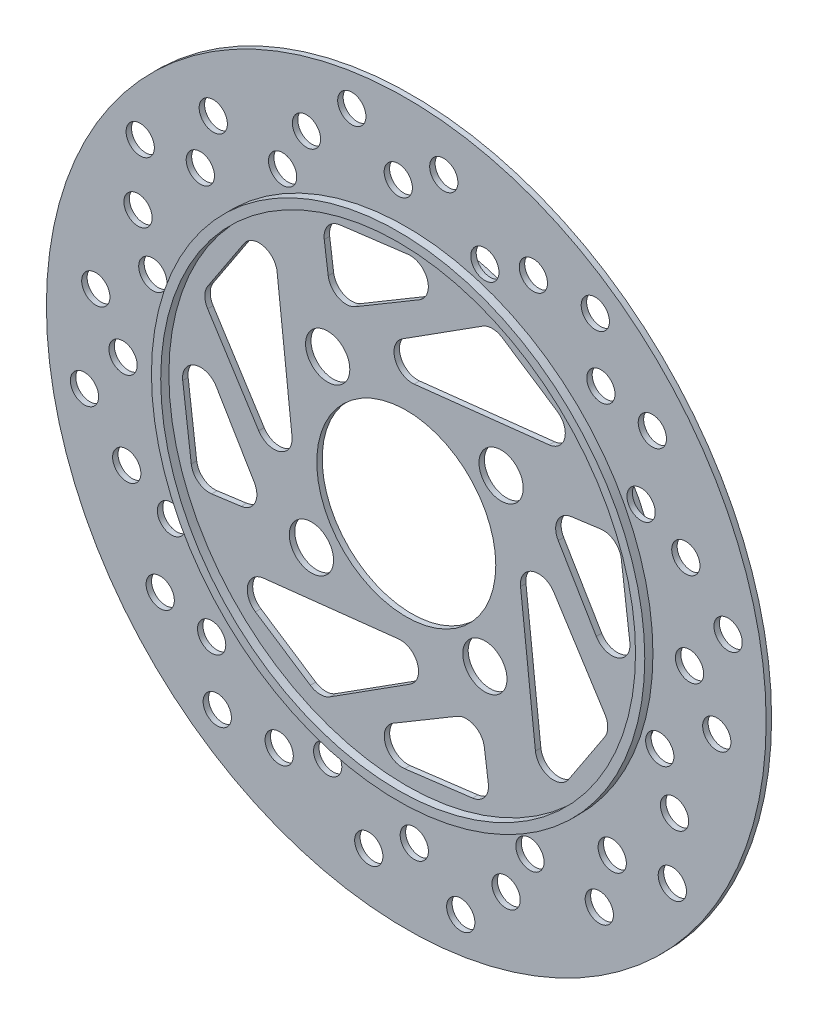
from build123d import *

# Parameters (mm, degrees)
SKETCH2_R             = 198.40424038
SKETCH2_R_2           = 135.985879118
SKETCH2_R_3           = 7.784933854
BOSS_EXTRUDE2_DEPTH   = 1.5
SKETCH2_R_4           = 130.883760353
SKETCH2_R_5           = 49.343667584
SKETCH2_R_6           = 12.196246353
BOSS_EXTRUDE2_2_DEPTH = 1.5
SKETCH3_R             = 135.985879118
SKETCH3_R_2           = 130.883760353
BOSS_EXTRUDE3_DEPTH   = 6
SCALE1_SCALE          = 0.55


with BuildPart() as part:
    # Sketch2 → Boss-Extrude2 (new, symmetric)
    with BuildSketch(Plane.XY):
        with Locations((202.835151523, 204.337269437)):
            Circle(SKETCH2_R)
        with Locations((202.835151523, 205.328991248)):
            Circle(SKETCH2_R_2, mode=Mode.SUBTRACT)
        with Locations((31.671364892, 226.003469352)):
            Circle(SKETCH2_R_3, mode=Mode.SUBTRACT)
        with Locations((46.695167001, 200.915529744)):
            Circle(SKETCH2_R_3, mode=Mode.SUBTRACT)
        with Locations((48.726085629, 150.308347166)):
            Circle(SKETCH2_R_3, mode=Mode.SUBTRACT)
        with Locations((73.387276697, 137.156776347)):
            Circle(SKETCH2_R_3, mode=Mode.SUBTRACT)
        with Locations((25.436259388, 175.296925506)):
            Circle(SKETCH2_R_3, mode=Mode.SUBTRACT)
        with Locations((89.306721095, 312.615844559)):
            Circle(SKETCH2_R_3, mode=Mode.SUBTRACT)
        with Locations((96.423140967, 340.979129133)):
            Circle(SKETCH2_R_3, mode=Mode.SUBTRACT)
        with Locations((56.15931458, 309.533073513)):
            Circle(SKETCH2_R_3, mode=Mode.SUBTRACT)
        with Locations((54.958115451, 275.395086249)):
            Circle(SKETCH2_R_3, mode=Mode.SUBTRACT)
        with Locations((63.096645978, 248.657425903)):
            Circle(SKETCH2_R_3, mode=Mode.SUBTRACT)
        with Locations((198.421690018, 361.46897577)):
            Circle(SKETCH2_R_3, mode=Mode.SUBTRACT)
        with Locations((223.509629626, 376.492777879)):
            Circle(SKETCH2_R_3, mode=Mode.SUBTRACT)
        with Locations((172.803085781, 382.727883384)):
            Circle(SKETCH2_R_3, mode=Mode.SUBTRACT)
        with Locations((147.814507441, 359.438057143)):
            Circle(SKETCH2_R_3, mode=Mode.SUBTRACT)
        with Locations((134.662936621, 334.776866075)):
            Circle(SKETCH2_R_3, mode=Mode.SUBTRACT)
        with Locations((310.122004834, 318.857421676)):
            Circle(SKETCH2_R_3, mode=Mode.SUBTRACT)
        with Locations((338.485289407, 311.741001804)):
            Circle(SKETCH2_R_3, mode=Mode.SUBTRACT)
        with Locations((307.039233787, 352.004828191)):
            Circle(SKETCH2_R_3, mode=Mode.SUBTRACT)
        with Locations((272.901246523, 353.20602732)):
            Circle(SKETCH2_R_3, mode=Mode.SUBTRACT)
        with Locations((246.163586177, 345.067496794)):
            Circle(SKETCH2_R_3, mode=Mode.SUBTRACT)
        with Locations((358.975136044, 209.742452753)):
            Circle(SKETCH2_R_3, mode=Mode.SUBTRACT)
        with Locations((373.998938153, 184.654513145)):
            Circle(SKETCH2_R_3, mode=Mode.SUBTRACT)
        with Locations((380.234043658, 235.36105699)):
            Circle(SKETCH2_R_3, mode=Mode.SUBTRACT)
        with Locations((356.944217417, 260.349635331)):
            Circle(SKETCH2_R_3, mode=Mode.SUBTRACT)
        with Locations((332.283026349, 273.50120615)):
            Circle(SKETCH2_R_3, mode=Mode.SUBTRACT)
        with Locations((316.363581951, 98.042137937)):
            Circle(SKETCH2_R_3, mode=Mode.SUBTRACT)
        with Locations((309.247162079, 69.678853364)):
            Circle(SKETCH2_R_3, mode=Mode.SUBTRACT)
        with Locations((349.510988466, 101.124908984)):
            Circle(SKETCH2_R_3, mode=Mode.SUBTRACT)
        with Locations((350.712187595, 135.262896248)):
            Circle(SKETCH2_R_3, mode=Mode.SUBTRACT)
        with Locations((342.573657068, 162.000556594)):
            Circle(SKETCH2_R_3, mode=Mode.SUBTRACT)
        with Locations((207.248613028, 49.189006727)):
            Circle(SKETCH2_R_3, mode=Mode.SUBTRACT)
        with Locations((182.16067342, 34.165204618)):
            Circle(SKETCH2_R_3, mode=Mode.SUBTRACT)
        with Locations((232.867217265, 27.930099113)):
            Circle(SKETCH2_R_3, mode=Mode.SUBTRACT)
        with Locations((257.855795605, 51.219925354)):
            Circle(SKETCH2_R_3, mode=Mode.SUBTRACT)
        with Locations((271.007366424, 75.881116422)):
            Circle(SKETCH2_R_3, mode=Mode.SUBTRACT)
        with Locations((95.548298212, 91.80056082)):
            Circle(SKETCH2_R_3, mode=Mode.SUBTRACT)
        with Locations((67.185013639, 98.916980693)):
            Circle(SKETCH2_R_3, mode=Mode.SUBTRACT)
        with Locations((98.631069258, 58.653154305)):
            Circle(SKETCH2_R_3, mode=Mode.SUBTRACT)
        with Locations((132.769056523, 57.451955176)):
            Circle(SKETCH2_R_3, mode=Mode.SUBTRACT)
        with Locations((159.506716868, 65.590485703)):
            Circle(SKETCH2_R_3, mode=Mode.SUBTRACT)
    extrude(amount=BOSS_EXTRUDE2_DEPTH, both=True)



with BuildPart() as body_2:
    # Sketch2 → Boss-Extrude2 2 (new, symmetric)
    with BuildSketch(Plane.XY):
        with Locations((202.835151523, 205.328991248)):
            Circle(SKETCH2_R_4)
        with Locations((202.835151523, 204.337269437)):
            Circle(SKETCH2_R_5, mode=Mode.SUBTRACT)
        with Locations((255.112246252, 248.657425903)):
            Circle(SKETCH2_R_6, mode=Mode.SUBTRACT)
        with Locations((246.163586177, 153.051896519)):
            Circle(SKETCH2_R_6, mode=Mode.SUBTRACT)
        with Locations((150.558056793, 162.000556594)):
            Circle(SKETCH2_R_6, mode=Mode.SUBTRACT)
        with Locations((159.506716868, 257.606085978)):
            Circle(SKETCH2_R_6, mode=Mode.SUBTRACT)
        with BuildLine():
            Line((200.698620982, 286.687878698), (244.877034585, 314.829477394))
            ThreePointArc((244.877034585, 314.829477394), (250.326597214, 316.394993603), (255.751407061, 314.745747721))
            Line((255.751407061, 314.745747721), (285.998616921, 294.816990442))
            ThreePointArc((285.998616921, 294.816990442), (290.218832114, 284.125095779), (281.59365068, 276.526867497))
            Line((281.59365068, 276.526867497), (207.168027217, 268.314026079))
            ThreePointArc((207.168027217, 268.314026079), (196.638793414, 274.932558961), (200.698620982, 286.687878698))
        make_face(mode=Mode.SUBTRACT)
        with BuildLine():
            Line((286.596533548, 233.348610429), (307.562458602, 198.071046871))
            ThreePointArc((307.562458602, 198.071046871), (319.405249777, 193.721627364), (326.08082099, 204.427041968))
            Line((326.08082099, 204.427041968), (321.371799778, 241.894235315))
            ThreePointArc((321.371799778, 241.894235315), (317.54892079, 248.571943285), (310.115019461, 250.557717322))
            Line((310.115019461, 250.557717322), (293.858115619, 248.368087534))
            ThreePointArc((293.858115619, 248.368087534), (286.189974245, 242.810317791), (286.596533548, 233.348610429))
        make_face(mode=Mode.SUBTRACT)
        with BuildLine():
            Line((312.251907995, 152.412735711), (292.323150717, 122.16552585))
            ThreePointArc((292.323150717, 122.16552585), (281.631256053, 117.945310657), (274.033027772, 126.570492091))
            Line((274.033027772, 126.570492091), (265.820186353, 200.996115554))
            ThreePointArc((265.820186353, 200.996115554), (272.438719235, 211.525349357), (284.194038972, 207.465521789))
            Line((284.194038972, 207.465521789), (312.335637668, 163.287108187))
            ThreePointArc((312.335637668, 163.287108187), (313.901153878, 157.837545557), (312.251907995, 152.412735711))
        make_face(mode=Mode.SUBTRACT)
        with BuildLine():
            Line((230.854770704, 121.567609223), (195.577207145, 100.601684169))
            ThreePointArc((195.577207145, 100.601684169), (191.227787639, 88.758892994), (201.933202243, 82.083321781))
            Line((201.933202243, 82.083321781), (239.400395589, 86.792342993))
            ThreePointArc((239.400395589, 86.792342993), (246.078103559, 90.615221982), (248.063877596, 98.04912331))
            Line((248.063877596, 98.04912331), (245.874247808, 114.306027152))
            ThreePointArc((245.874247808, 114.306027152), (240.316478065, 121.974168527), (230.854770704, 121.567609223))
        make_face(mode=Mode.SUBTRACT)
        with BuildLine():
            Line((149.918895985, 95.912234776), (119.671686125, 115.840992054))
            ThreePointArc((119.671686125, 115.840992054), (115.451470931, 126.532886718), (124.076652365, 134.131115))
            Line((124.076652365, 134.131115), (198.502275828, 142.343956418))
            ThreePointArc((198.502275828, 142.343956418), (209.031509632, 135.725423536), (204.971682064, 123.970103799))
            Line((204.971682064, 123.970103799), (160.793268461, 95.828505103))
            ThreePointArc((160.793268461, 95.828505103), (155.343705832, 94.262988894), (149.918895985, 95.912234776))
        make_face(mode=Mode.SUBTRACT)
        with BuildLine():
            Line((119.073769497, 177.309372068), (98.107844444, 212.586935626))
            ThreePointArc((98.107844444, 212.586935626), (86.265053269, 216.936355132), (79.589482056, 206.230940529))
            Line((79.589482056, 206.230940529), (84.298503268, 168.763747182))
            ThreePointArc((84.298503268, 168.763747182), (88.121382256, 162.086039212), (95.555283585, 160.100265175))
            Line((95.555283585, 160.100265175), (111.812187426, 162.289894963))
            ThreePointArc((111.812187426, 162.289894963), (119.480328801, 167.847664706), (119.073769497, 177.309372068))
        make_face(mode=Mode.SUBTRACT)
        with BuildLine():
            Line((93.418395051, 258.245246786), (113.347152329, 288.492456646))
            ThreePointArc((113.347152329, 288.492456646), (124.039046993, 292.71267184), (131.637275274, 284.087490406))
            Line((131.637275274, 284.087490406), (139.850116692, 209.661866943))
            ThreePointArc((139.850116692, 209.661866943), (133.23158381, 199.13263314), (121.476264074, 203.192460707))
            Line((121.476264074, 203.192460707), (93.334665377, 247.37087431))
            ThreePointArc((93.334665377, 247.37087431), (91.769149168, 252.82043694), (93.418395051, 258.245246786))
        make_face(mode=Mode.SUBTRACT)
        with BuildLine():
            Line((174.815532342, 289.090373274), (210.093095901, 310.056298327))
            ThreePointArc((210.093095901, 310.056298327), (214.442515407, 321.899089503), (203.737100803, 328.574660716))
            Line((203.737100803, 328.574660716), (166.269907456, 323.865639503))
            ThreePointArc((166.269907456, 323.865639503), (159.592199487, 320.042760515), (157.60642545, 312.608859186))
            Line((157.60642545, 312.608859186), (159.796055238, 296.351955345))
            ThreePointArc((159.796055238, 296.351955345), (165.353824981, 288.68381397), (174.815532342, 289.090373274))
        make_face(mode=Mode.SUBTRACT)
    extrude(amount=BOSS_EXTRUDE2_2_DEPTH, both=True)


with BuildPart() as part_1:
    add(part.part)

    add(body_2.part)  # Boss-Extrude3 merges body 2
    # Sketch3 → Boss-Extrude3 (add, symmetric)
    with BuildSketch(Plane.XY):
        with Locations((202.835151523, 205.328991248)):
            Circle(SKETCH3_R)
        with Locations((202.835151523, 205.328991248)):
            Circle(SKETCH3_R_2, mode=Mode.SUBTRACT)
    extrude(amount=BOSS_EXTRUDE3_DEPTH, both=True)


with BuildPart() as part_2:
    # Scale1: scaled about (202.835151523, 204.1987921, 0)
    add(part_1.part.scale(SCALE1_SCALE).moved(Location((91.275818185, 91.889456445, 0))))


solid = part_2.part
